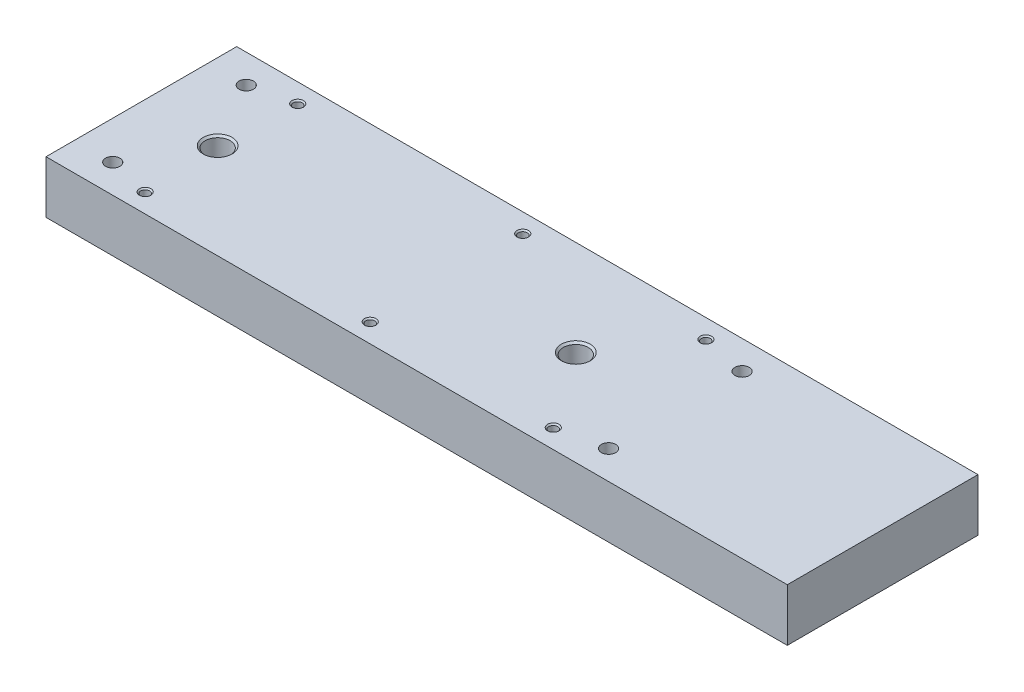
from build123d import *

# Parameters (mm, degrees)
SKETCH1_W                                 = 246.825
SKETCH1_H                                 = 63.5
BOSS_EXTRUDE1_DEPTH                       = 17.5
HOLE1_AT_2_COUNT                          = 2
HOLE1_AT_2_PITCH                          = 44.45
HOLE1_AT_3_COUNT                          = 2
HOLE1_AT_3_PITCH                          = 165.1
HOLE1_AT_4_COUNT                          = 2
HOLE1_AT_4_PITCH                          = 170.978982627
F_4_CLEARANCE_HOLE1_AT_2_COUNT            = 2
F_4_CLEARANCE_HOLE1_AT_2_PITCH            = 74.93
F_4_CLEARANCE_HOLE1_AT_3_COUNT            = 2
F_4_CLEARANCE_HOLE1_AT_3_PITCH            = 135.89
F_4_CLEARANCE_HOLE1_AT_4_COUNT            = 2
F_4_CLEARANCE_HOLE1_AT_4_PITCH            = 50.8
F_4_CLEARANCE_HOLE1_AT_5_COUNT            = 2
F_4_CLEARANCE_HOLE1_AT_5_PITCH            = 90.527039607
F_4_CLEARANCE_HOLE1_AT_6_COUNT            = 2
F_4_CLEARANCE_HOLE1_AT_6_PITCH            = 145.074918921
F_21_64_0_32813_DIAMETER_HOLE1_AT_2_COUNT = 2
F_21_64_0_32813_DIAMETER_HOLE1_AT_2_PITCH = 119.253


with BuildPart() as part:
    # Sketch1 → Boss-Extrude1 (new body)
    with BuildSketch(Plane(origin=(0, 0, 0), x_dir=(1, 0, 0), z_dir=(0, 1, 0))):
        with Locations((28.1625, 0)):
            Rectangle(SKETCH1_W, SKETCH1_H)
    extrude(amount=BOSS_EXTRUDE1_DEPTH)

    # Sketch2 → Hole1 (revolve, cut)
    with BuildSketch(Plane(origin=(82.55, 0, 22.225), x_dir=(0, 0, -1), z_dir=(1, 0, 0))):
        Polygon((0, 0), (0, 17.5), (2.38125, 17.5), (2.38125, 5.02895), (2.75, 4.6602), (4.1275, 4.6602), (4.1275, 0.6225), (4.75, 0), align=None)
    hole1 = revolve(axis=Axis((82.55, -6.35, 22.225), (0, 1, 0)), mode=Mode.SUBTRACT)

    # Hole1 at 2: Hole1 ×2
    with Locations(*[(0, 0, -i * HOLE1_AT_2_PITCH) for i in range(1, HOLE1_AT_2_COUNT)]):
        add(hole1, mode=Mode.SUBTRACT)

    # Hole1 at 3: Hole1 ×2
    with Locations(*[(-i * HOLE1_AT_3_PITCH, 0, 0) for i in range(1, HOLE1_AT_3_COUNT)]):
        add(hole1, mode=Mode.SUBTRACT)

    # Hole1 at 4: Hole1 ×2
    with Locations(*[Vector(-0.9656157585206697, 0, -0.2599734734478725) * (i * HOLE1_AT_4_PITCH) for i in range(1, HOLE1_AT_4_COUNT)]):
        add(hole1, mode=Mode.SUBTRACT)

    # Sketch4 → #4 Clearance Hole1 (revolve, cut)
    with BuildSketch(Plane(origin=(-68.58, 0, -25.4), x_dir=(0, 0, -1), z_dir=(1, 0, 0))):
        Polygon((0, 0), (0, 17.5), (1.905, 17.5), (1.4732, 17.0682), (1.4732, 2.9718), (1.905, 2.54), (3.175, 2.54), (3.175, 0.254), (3.429, 0), align=None)
    f_4_clearance_hole1 = revolve(axis=Axis((-68.58, -6.35, -25.4), (0, 1, 0)), mode=Mode.SUBTRACT)

    # #4 Clearance Hole1 at 2: #4 Clearance Hole1 ×2
    with Locations(*[(i * F_4_CLEARANCE_HOLE1_AT_2_PITCH, 0, 0) for i in range(1, F_4_CLEARANCE_HOLE1_AT_2_COUNT)]):
        add(f_4_clearance_hole1, mode=Mode.SUBTRACT)

    # #4 Clearance Hole1 at 3: #4 Clearance Hole1 ×2
    with Locations(*[(i * F_4_CLEARANCE_HOLE1_AT_3_PITCH, 0, 0) for i in range(1, F_4_CLEARANCE_HOLE1_AT_3_COUNT)]):
        add(f_4_clearance_hole1, mode=Mode.SUBTRACT)

    # #4 Clearance Hole1 at 4: #4 Clearance Hole1 ×2
    with Locations(*[(0, 0, i * F_4_CLEARANCE_HOLE1_AT_4_PITCH) for i in range(1, F_4_CLEARANCE_HOLE1_AT_4_COUNT)]):
        add(f_4_clearance_hole1, mode=Mode.SUBTRACT)

    # #4 Clearance Hole1 at 5: #4 Clearance Hole1 ×2
    with Locations(*[Vector(0.8277084982047687, 0, 0.56115830386764) * (i * F_4_CLEARANCE_HOLE1_AT_5_PITCH) for i in range(1, F_4_CLEARANCE_HOLE1_AT_5_COUNT)]):
        add(f_4_clearance_hole1, mode=Mode.SUBTRACT)

    # #4 Clearance Hole1 at 6: #4 Clearance Hole1 ×2
    with Locations(*[Vector(0.9366884435330111, 0, 0.35016390412449033) * (i * F_4_CLEARANCE_HOLE1_AT_6_PITCH) for i in range(1, F_4_CLEARANCE_HOLE1_AT_6_COUNT)]):
        add(f_4_clearance_hole1, mode=Mode.SUBTRACT)

    # Sketch8 → 21/64 (0.32813) Diameter Hole1 (revolve, cut)
    with BuildSketch(Plane(origin=(-69.85, 0, 0), x_dir=(0, 0, -1), z_dir=(1, 0, 0))):
        Polygon((0, 0), (0, 17.5), (4.802251, 17.5), (4.167251, 16.865), (4.167251, 0.635), (4.802251, 0), align=None)
    f_21_64_0_32813_diameter_hole1 = revolve(axis=Axis((-69.85, -6.35, 0), (0, 1, 0)), mode=Mode.SUBTRACT)

    # 21/64 (0.32813) Diameter Hole1 at 2: 21/64 (0.32813) Diameter Hole1 ×2
    with Locations(*[(i * F_21_64_0_32813_DIAMETER_HOLE1_AT_2_PITCH, 0, 0) for i in range(1, F_21_64_0_32813_DIAMETER_HOLE1_AT_2_COUNT)]):
        add(f_21_64_0_32813_diameter_hole1, mode=Mode.SUBTRACT)


solid = part.part
